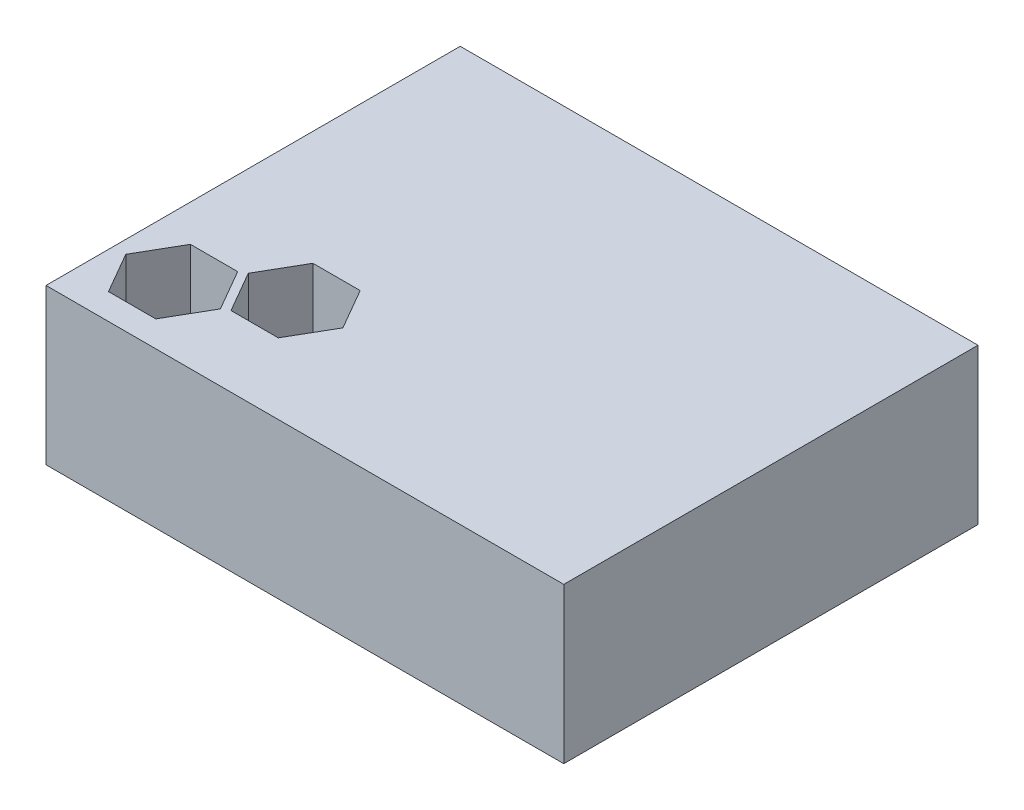
from build123d import *

# Parameters (mm, degrees)
SKETCH1_W           = 10
SKETCH1_H           = 8
BOSS_EXTRUDE1_DEPTH = 3
CUT_EXTRUDE1_REACH  = 15.153


with BuildPart() as part:
    # Sketch1 → Boss-Extrude1 (new body)
    with BuildSketch(Plane(origin=(0, 0, 0), x_dir=(1, 0, 0), z_dir=(0, 1, 0))):
        with Locations((5, 4)):
            Rectangle(SKETCH1_W, SKETCH1_H)
    extrude(amount=BOSS_EXTRUDE1_DEPTH)

    # Sketch2 → Cut-Extrude1 (cut, up to next)
    with BuildSketch(Plane(origin=(0, 3, 0), x_dir=(1, 0, 0), z_dir=(0, 1, 0)), mode=Mode.PRIVATE) as cut_extrude1_sk1:
        Polygon((2.076794919, 1.291025404), (1.620096189, 2.082050808), (0.70669873, 2.082050808), (0.25, 1.291025404), (0.70669873, 0.5), (1.620096189, 0.5), align=None)
    cut_extrude1_tool1 = extrude(cut_extrude1_sk1.sketch, amount=-CUT_EXTRUDE1_REACH, mode=Mode.PRIVATE) & part.part
    # Sketch2 → Cut-Extrude1 (cut, up to next)
    with BuildSketch(Plane(origin=(0, 3, 0), x_dir=(1, 0, 0), z_dir=(0, 1, 0)), mode=Mode.PRIVATE) as cut_extrude1_sk2:
        Polygon((3.576794919, 2.157050808), (3.120096189, 2.948076211), (2.20669873, 2.948076211), (1.75, 2.157050808), (2.20669873, 1.366025404), (3.120096189, 1.366025404), align=None)
    cut_extrude1_tool2 = extrude(cut_extrude1_sk2.sketch, amount=-CUT_EXTRUDE1_REACH, mode=Mode.PRIVATE) & part.part
    add(cut_extrude1_tool1.solids().sort_by_distance((1.163397, 3, -1.291025))[0], mode=Mode.SUBTRACT)
    add(cut_extrude1_tool2.solids().sort_by_distance((2.663397, 3, -2.157051))[0], mode=Mode.SUBTRACT)


solid = part.part
